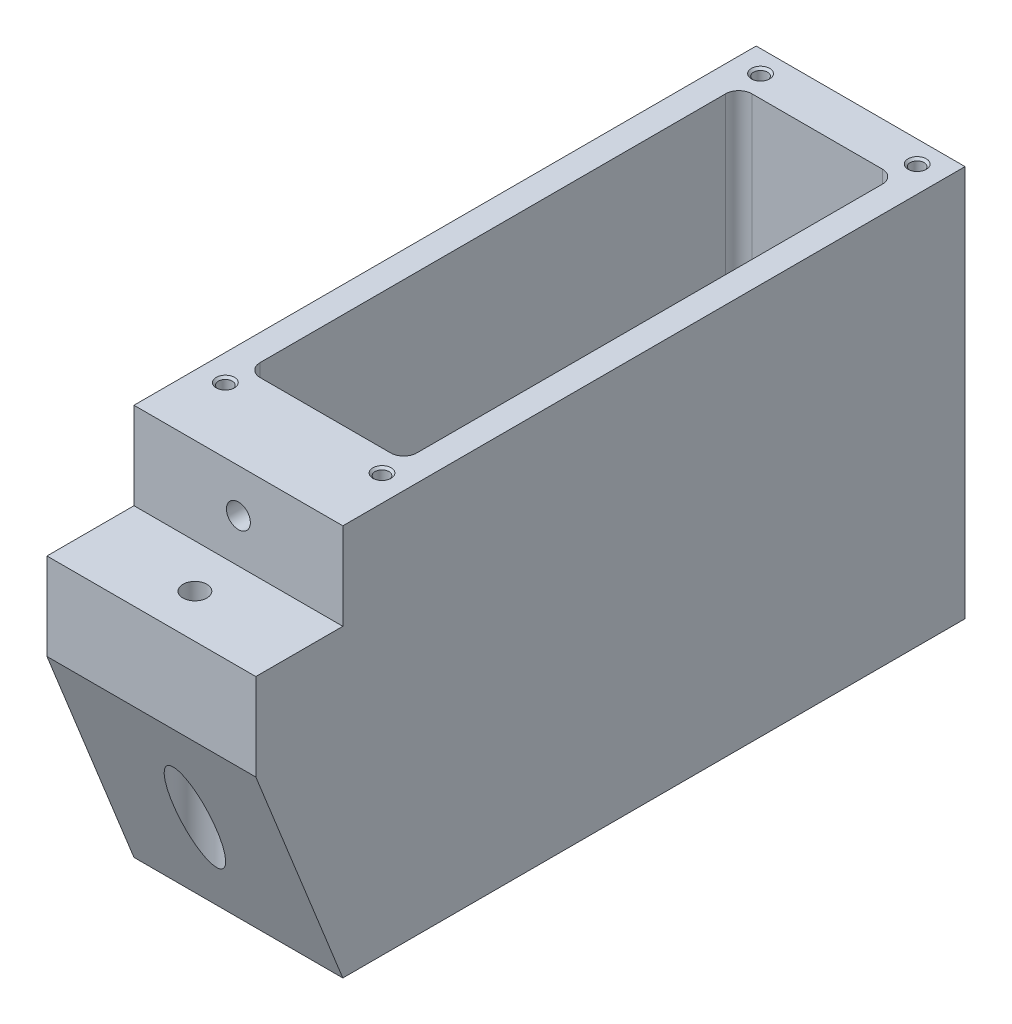
from build123d import *

# Parameters (mm, degrees)
BOSS_EXTRUDE1_DEPTH            = 9
BOSS_EXTRUDE2_DEPTH            = 6
SKETCH3_W                      = 10
SKETCH3_H                      = 90
BOSS_EXTRUDE3_DEPTH            = 9
FILLET1_R                      = 3
FILLET1_OF_MIRROR4_R           = 3
FILLET2_R                      = 3
F_2_5MM_DOWEL_HOLE1_D          = 3.2
F_2_5MM_DOWEL_HOLE1_DEPTH      = 6.5
F_2_5MM_DOWEL_HOLE1_TIP        = 0.96137699
CHAMFER1_SIZE                  = 0.5
SKETCH8_R                      = 5
CUT_EXTRUDE1_DEPTH             = 158.203689524
CBORE_FOR_M5_SHCS2_D           = 5.5
CBORE_FOR_M5_SHCS2_DEPTH       = 40
CBORE_FOR_M5_SHCS2_CBORE_D     = 10
CBORE_FOR_M5_SHCS2_CBORE_DEPTH = 5


with BuildPart() as part:
    # Sketch1 → Boss-Extrude1 (new body)
    with BuildSketch(Plane(origin=(0, 0, 0), x_dir=(0, 0, -1), z_dir=(1, 0, 0))):
        Polygon((0, 0), (0, -20), (-20, -20), (-20, -40), (0, -90), (143, -90), (143, 0), (133, 0), (133, -76.5), (20, -76.5), (20, 0), align=None)
    boss_extrude1 = extrude(amount=BOSS_EXTRUDE1_DEPTH)

    # Sketch2 → Boss-Extrude2 (add)
    with BuildSketch(Plane.ZY):
        Polygon((0, 0), (-143, 0), (-143, -90), (0, -90), (20, -40), (20, -20), (0, -20), align=None)
    boss_extrude2 = extrude(amount=BOSS_EXTRUDE2_DEPTH)

    # Sketch3 → Boss-Extrude3 (add)
    with BuildSketch(Plane(origin=(9, 0, 0), x_dir=(0, 0, -1), z_dir=(1, 0, 0))):
        Polygon((0, -90), (20, -90), (20, 0), (0, 0), (0, -20), (-20, -20), (-20, -40), align=None)
        with Locations((138, -45)):
            Rectangle(SKETCH3_W, SKETCH3_H)
    boss_extrude3 = extrude(amount=BOSS_EXTRUDE3_DEPTH)

    # Fillet1
    fillet1_edges = [part.edges().sort_by_distance(p)[0] for p in [
        (4.5, -76.5, -20),
        (4.5, -76.5, -133),
        (9, -83.25, -133),
        (9, -83.25, -20),
    ]]
    fillet(fillet1_edges, radius=FILLET1_R)

    # Mirror4: Boss-Extrude1, Boss-Extrude2, Boss-Extrude3 across plane
    add(boss_extrude1.mirror(Plane(origin=(18, 0, 0), x_dir=(0, 0, 1), z_dir=(1, 0, 0))))
    add(boss_extrude2.mirror(Plane(origin=(18, 0, 0), x_dir=(0, 0, 1), z_dir=(1, 0, 0))))
    add(boss_extrude3.mirror(Plane(origin=(18, 0, 0), x_dir=(0, 0, 1), z_dir=(1, 0, 0))))

    # Fillet1 of Mirror4
    fillet1_of_mirror4_edges = [part.edges().sort_by_distance(p)[0] for p in [
        (31.5, -76.5, -20),
        (31.5, -76.5, -133),
        (27, -83.25, -133),
        (27, -83.25, -20),
    ]]
    fillet(fillet1_of_mirror4_edges, radius=FILLET1_OF_MIRROR4_R)

    # Fillet2
    fillet2_edges = [part.edges().sort_by_distance(p)[0] for p in [
        (36, -76.5, -76.5),
        (36, -36.75, -20),
        (36, -36.75, -133),
        (36, -75.621320344, -20.878679656),
        (36, -75.621320344, -132.121320344),
        (0, -36.75, -133),
        (0, -36.75, -20),
        (0, -76.5, -76.5),
        (0, -75.621320344, -20.878679656),
        (0, -75.621320344, -132.121320344),
    ]]
    fillet(fillet2_edges, radius=FILLET2_R)

    # Ø2.5mm Dowel Hole1
    with Locations(Plane(origin=(0, 0, 0), x_dir=(1, 0, 0), z_dir=(0, 1, 0))):
        with Locations((36, 138), (0, 138), (0, 15), (36, 15)):
            Hole(F_2_5MM_DOWEL_HOLE1_D / 2, depth=F_2_5MM_DOWEL_HOLE1_DEPTH)
            with Locations((0, 0, -(F_2_5MM_DOWEL_HOLE1_DEPTH + F_2_5MM_DOWEL_HOLE1_TIP / 2))):  # 118° drill point
                Cone(0, F_2_5MM_DOWEL_HOLE1_D / 2, F_2_5MM_DOWEL_HOLE1_TIP, mode=Mode.SUBTRACT)

    # Chamfer1
    chamfer1_edges = [part.edges().sort_by_distance(p)[0] for p in [
        (37.6, 0, -138),
        (37.6, 0, -15),
        (1.6, 0, -15),
        (1.6, 0, -138),
    ]]
    chamfer(chamfer1_edges, length=CHAMFER1_SIZE)

    # Sketch7 → CBORE for M5 SHCS1 (revolve, cut)
    with BuildSketch(Plane(origin=(18, -40, 10), x_dir=(0, 0, -1), z_dir=(1, 0, 0))):
        Polygon((0, 0), (0, 40), (2.75, 40), (2.75, 5), (5, 5), (5, 0), align=None)
    revolve(axis=Axis((18, -46.35, 10), (0, 1, 0)), mode=Mode.SUBTRACT)

    # Sketch8 → Cut-Extrude1 (cut, through all)
    with BuildSketch(Plane(origin=(0, -40, 0), x_dir=(1, 0, 0), z_dir=(0, 1, 0))):
        with Locations(Location((18, -10, 0), (0, 0, 90))):
            Circle(SKETCH8_R)
    extrude(amount=-CUT_EXTRUDE1_DEPTH, mode=Mode.SUBTRACT)

    # CBORE for M5 SHCS2
    with Locations(Plane(origin=(0, 0, -20), x_dir=(-1, 0, 0), z_dir=(0, 0, -1))):
        with Locations((-18, -10)):
            CounterBoreHole(CBORE_FOR_M5_SHCS2_D / 2, CBORE_FOR_M5_SHCS2_CBORE_D / 2, CBORE_FOR_M5_SHCS2_CBORE_DEPTH, depth=CBORE_FOR_M5_SHCS2_DEPTH)


solid = part.part
